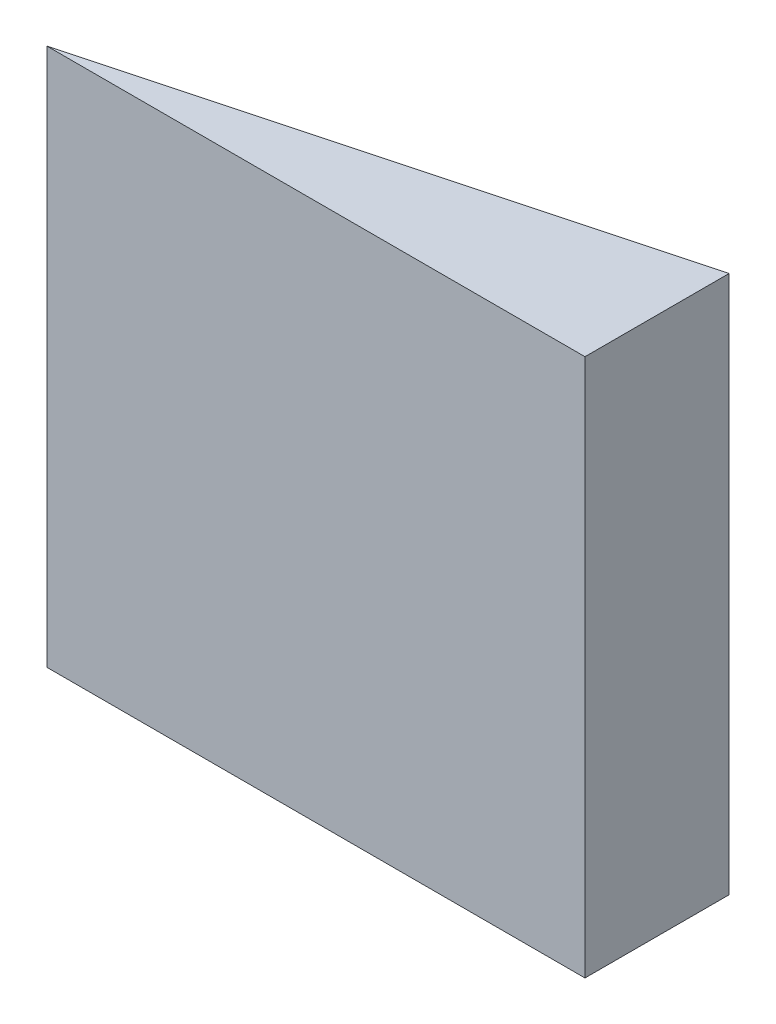
from build123d import *

# Parameters (mm, degrees)
BOSS_EXTRUDE1_DEPTH = 48


with BuildPart() as part:
    # Sketch1 → Boss-Extrude1 (new body)
    with BuildSketch(Plane(origin=(0, 0, 0), x_dir=(1, 0, 0), z_dir=(0, 1, 0))):
        Polygon((0, 0), (48.006, 0), (48.006, 12.863168932), align=None)
    extrude(amount=BOSS_EXTRUDE1_DEPTH)


solid = part.part
